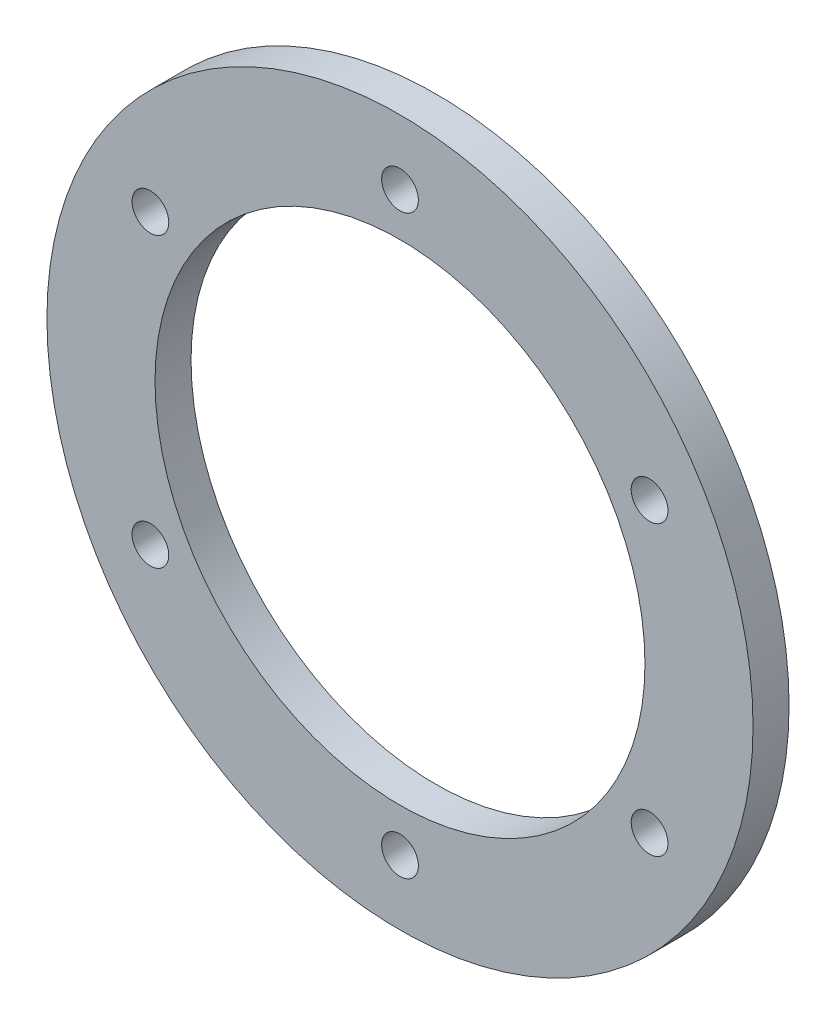
from build123d import *

# Parameters (mm, degrees)
SKETCH1_R           = 49
SKETCH1_R_2         = 34
BOSS_EXTRUDE1_DEPTH = 5
SKETCH2_R           = 2.55
CUT_EXTRUDE1_DEPTH  = 70.476614771


with BuildPart() as part:
    # Sketch1 → Boss-Extrude1 (new body)
    with BuildSketch(Plane.XY):
        Circle(SKETCH1_R)
        Circle(SKETCH1_R_2, mode=Mode.SUBTRACT)
    extrude(amount=BOSS_EXTRUDE1_DEPTH)

    # Sketch2 → Cut-Extrude1 (cut, through all)
    with BuildSketch(Plane.XY):
        with Locations((0, 40)):
            Circle(SKETCH2_R)
        with Locations((34.641016151, 20)):
            Circle(SKETCH2_R)
        with Locations((34.641016151, -20)):
            Circle(SKETCH2_R)
        with Locations((0, -40)):
            Circle(SKETCH2_R)
        with Locations((-34.641016151, -20)):
            Circle(SKETCH2_R)
        with Locations((-34.641016151, 20)):
            Circle(SKETCH2_R)
    extrude(amount=CUT_EXTRUDE1_DEPTH, mode=Mode.SUBTRACT)


solid = part.part
